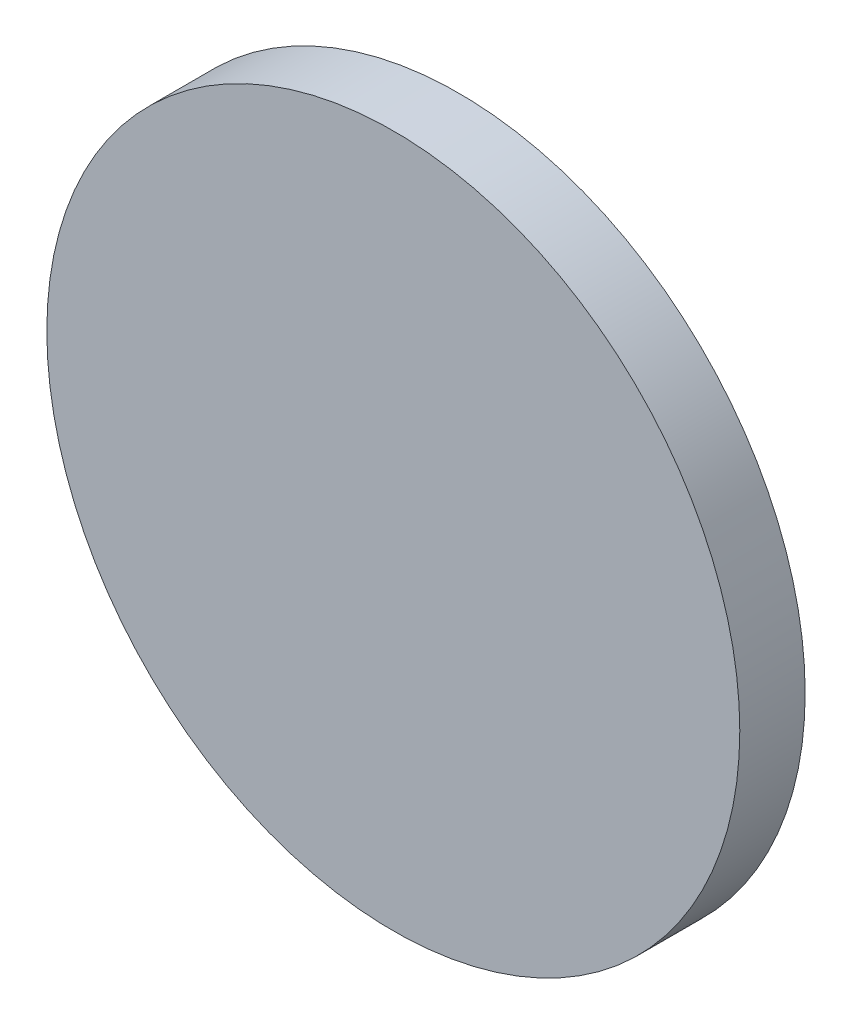
from build123d import *

# Parameters (mm, degrees)
SKETCH1_R           = 1346.2
BOSS_EXTRUDE3_DEPTH = 254


with BuildPart() as part:
    # Sketch1 → Boss-Extrude3 (new body)
    with BuildSketch(Plane.XY):
        Circle(SKETCH1_R)
    extrude(amount=BOSS_EXTRUDE3_DEPTH)


solid = part.part
